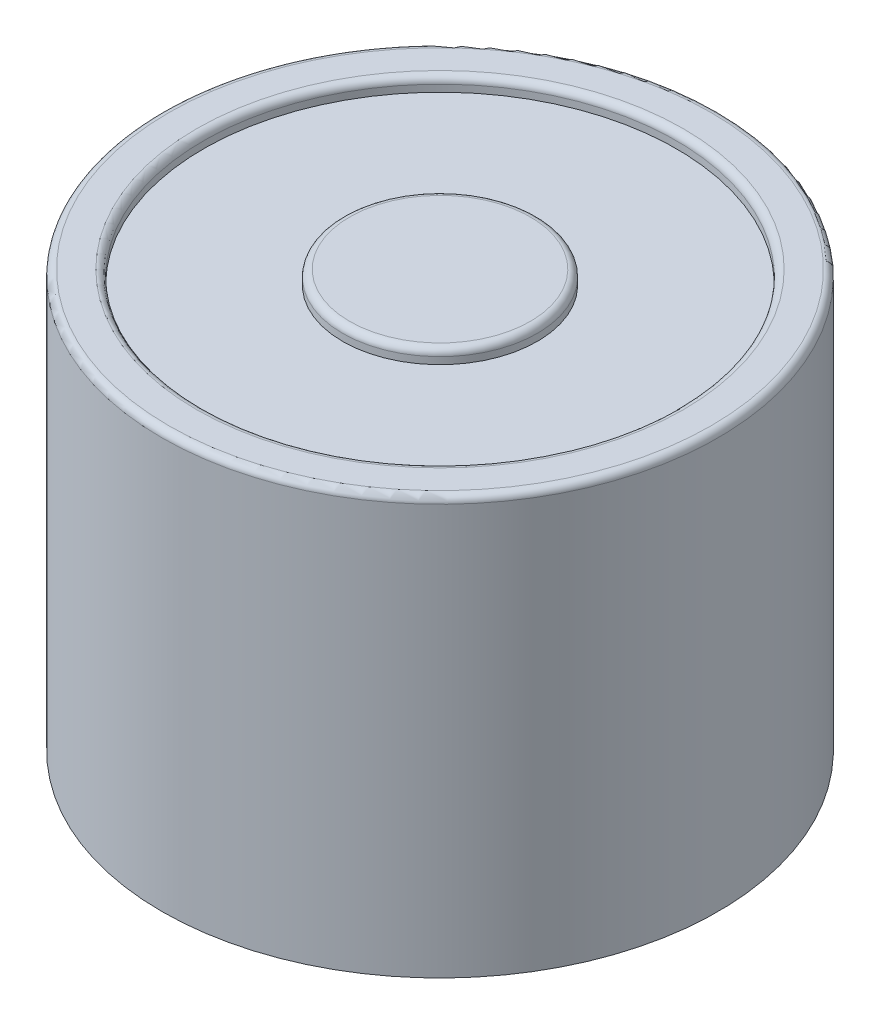
from build123d import *

# Parameters (mm, degrees)
SKETCH1_R           = 10
BOSS_EXTRUDE1_DEPTH = 15
SKETCH2_R           = 8.5
CUT_EXTRUDE1_DEPTH  = 0.5
SKETCH3_R           = 3.5
BOSS_EXTRUDE2_DEPTH = 0.5
FILLET1_R           = 0.25


with BuildPart() as part:
    # Sketch1 → Boss-Extrude1 (new body)
    with BuildSketch(Plane(origin=(0, 0, 0), x_dir=(1, 0, 0), z_dir=(0, 1, 0))):
        with Locations(Location((0, 0, 0), (0, 0, 270))):
            Circle(SKETCH1_R)
    extrude(amount=BOSS_EXTRUDE1_DEPTH)

    # Sketch2 → Cut-Extrude1 (cut)
    with BuildSketch(Plane(origin=(0, 15, 0), x_dir=(1, 0, 0), z_dir=(0, 1, 0))):
        with Locations(Location((0, 0, 0), (0, 0, 270))):
            Circle(SKETCH2_R)
    extrude(amount=-CUT_EXTRUDE1_DEPTH, mode=Mode.SUBTRACT)

    # Sketch3 → Boss-Extrude2 (add)
    with BuildSketch(Plane(origin=(0, 14.5, 0), x_dir=(1, 0, 0), z_dir=(0, 1, 0))):
        with Locations(Location((0, 0, 0), (0, 0, 270))):
            Circle(SKETCH3_R)
    extrude(amount=BOSS_EXTRUDE2_DEPTH)

    # Fillet1
    fillet1_edges = [part.edges().sort_by_distance(p)[0] for p in [
        (0, 15, -3.5),
        (0, 15, -10),
        (0, 15, -8.5),
    ]]
    fillet(fillet1_edges, radius=FILLET1_R)


solid = part.part
